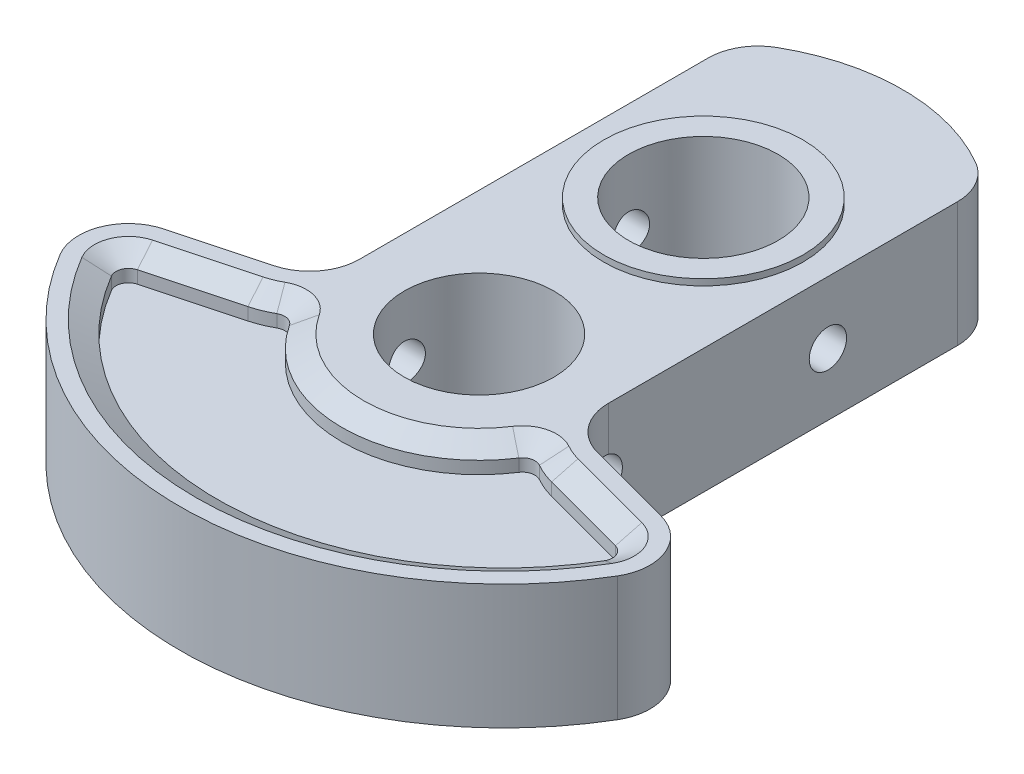
from build123d import *
from OCP.BRepFilletAPI import BRepFilletAPI_MakeChamfer

# Parameters (mm, degrees)
BOSS_EXTRUDE1_DEPTH     = 5
FILLET1_R               = 4
SKETCH3_R               = 8
BOSS_EXTRUDE2_DEPTH     = 0.5
SKETCH4_R               = 8
BOSS_EXTRUDE3_DEPTH     = 0.5
SKETCH5_R               = 6
CUT_EXTRUDE3_DEPTH      = 43.458169908
CUT_EXTRUDE4_DEPTH      = 2
CHAMFER1_SIZE           = 1
CHAMFER1_SIZE2          = 1.732050808
CHAMFER2_SIZE           = 1
CHAMFER2_SIZE2          = 1.732050808
CUT_EXTRUDE5_DEPTH      = 42.375671498
CUT_EXTRUDE5_DEPTH_BACK = 42.375671498
SKETCH7_R               = 1.5


with BuildPart() as part:
    # Sketch1 → Boss-Extrude1 (new, symmetric)
    with BuildSketch(Plane(origin=(0, 0, 0), x_dir=(1, 0, 0), z_dir=(0, 1, 0))):
        with BuildLine():
            Line((-10, 30.489995997), (-10, -2.679491924))
            Line((-10, -2.679491924), (-24.544650839, -6.576719371))
            ThreePointArc((-24.544650839, -6.576719371), (0, -24), (24.544650839, -6.576719371))
            Line((24.544650839, -6.576719371), (10, -2.679491924))
            Line((10, -2.679491924), (10, 30.489995997))
            ThreePointArc((10, 30.489995997), (0, 34), (-10, 30.489995997))
        make_face()
    extrude(amount=BOSS_EXTRUDE1_DEPTH, both=True)

    # Fillet1
    fillet1_edges = [part.edges().sort_by_distance(p)[0] for p in [
        (10, 0, -30.489995997),
        (10, 0, 2.679491924),
        (24.544650839, 0, 6.576719371),
        (-24.544650839, 0, 6.576719371),
        (-10, 0, 2.679491924),
        (-10, 0, -30.489995997),
    ]]
    fillet(fillet1_edges, radius=FILLET1_R)

    # Sketch3 → Boss-Extrude2 (add, symmetric)
    with BuildSketch(Plane.XZ.offset(5)):
        with Locations(Location((0, 0, 0), (0, 0, 90))):
            Circle(SKETCH3_R)
    extrude(amount=BOSS_EXTRUDE2_DEPTH, both=True)

    # Sketch4 → Boss-Extrude3 (add, symmetric)
    with BuildSketch(Plane(origin=(0, 5, 0), x_dir=(1, 0, 0), z_dir=(0, 1, 0))):
        with Locations(Location((0, 18, 0), (0, 0, 270))):
            Circle(SKETCH4_R)
    extrude(amount=BOSS_EXTRUDE3_DEPTH, both=True)

    # Sketch5 → Cut-Extrude3 (cut, through all)
    with BuildSketch(Plane.XZ.offset(5.5)):
        with Locations(Location((0, 0, 0), (0, 0, 270))):
            Circle(SKETCH5_R)
        with Locations(Location((0, -18, 0), (0, 0, 270))):
            Circle(SKETCH5_R)
    extrude(amount=-CUT_EXTRUDE3_DEPTH, mode=Mode.SUBTRACT)

    # Sketch6 → Cut-Extrude4 (cut)
    with BuildSketch(Plane(origin=(0, 5, 0), x_dir=(1, 0, 0), z_dir=(0, 1, 0))):
        with BuildLine():
            Line((12.188266684, -6.371664756), (19.186884641, -8.246938786))
            ThreePointArc((19.186884641, -8.246938786), (19.854075356, -8.835365045), (19.788432213, -9.722540276))
            ThreePointArc((19.788432213, -9.722540276), (0, -21), (-19.788432213, -9.722540276))
            ThreePointArc((-19.788432213, -9.722540276), (-19.854075356, -8.835365045), (-19.186884641, -8.246938786))
            Line((-19.186884641, -8.246938786), (-12.188266684, -6.371664756))
            ThreePointArc((-12.188266684, -6.371664756), (-11.342355786, -6.086056673), (-10.539679728, -5.695098402))
            ThreePointArc((-10.539679728, -5.695098402), (-9.810114884, -5.592432974), (-9.208235905, -6.017340901))
            ThreePointArc((-9.208235905, -6.017340901), (0, -11), (9.208235905, -6.017340901))
            ThreePointArc((9.208235905, -6.017340901), (9.810114884, -5.592432974), (10.539679728, -5.695098402))
            ThreePointArc((10.539679728, -5.695098402), (11.342355786, -6.086056673), (12.188266684, -6.371664756))
        make_face()
    cut_extrude4 = extrude(amount=-CUT_EXTRUDE4_DEPTH, mode=Mode.SUBTRACT)

    # Chamfer1: one chamfer whose edges measure the first distance from different faces: ONE call of the kernel's chamfer builder (chamfer() names one face for all edges)
    chamfer1_edges_1 = [part.edges().sort_by_distance(p)[0] for p in [
        (9.810114884, 5, 5.592432974),
    ]]
    chamfer1_side_1 = [part.faces().sort_by_distance(p)[0] for p in [
        (9.810114884, 4, 5.592432974),
    ]]
    chamfer1_edges_2 = [part.edges().sort_by_distance(p)[0] for p in [
        (0, 5, 11),
    ]]
    chamfer1_side_2 = [part.faces().sort_by_distance(p)[0] for p in [
        (0, 4, 11),
    ]]
    chamfer1_edges_3 = [part.edges().sort_by_distance(p)[0] for p in [
        (-9.810114884, 5, 5.592432974),
    ]]
    chamfer1_side_3 = [part.faces().sort_by_distance(p)[0] for p in [
        (-9.810114884, 4, 5.592432974),
    ]]
    chamfer1_edges_4 = [part.edges().sort_by_distance(p)[0] for p in [
        (-11.342355786, 5, 6.086056673),
    ]]
    chamfer1_side_4 = [part.faces().sort_by_distance(p)[0] for p in [
        (-11.342355786, 4, 6.086056673),
    ]]
    chamfer1_edges_5 = [part.edges().sort_by_distance(p)[0] for p in [
        (-15.687575662, 5, 7.309301771),
    ]]
    chamfer1_side_5 = [part.faces().sort_by_distance(p)[0] for p in [
        (-15.687575662, 4, 7.309301771),
    ]]
    chamfer1_edges_6 = [part.edges().sort_by_distance(p)[0] for p in [
        (-19.854075356, 5, 8.835365045),
    ]]
    chamfer1_side_6 = [part.faces().sort_by_distance(p)[0] for p in [
        (-19.854075356, 4, 8.835365045),
    ]]
    chamfer1_edges_7 = [part.edges().sort_by_distance(p)[0] for p in [
        (0, 5, 21),
    ]]
    chamfer1_side_7 = [part.faces().sort_by_distance(p)[0] for p in [
        (0, 4, 21),
    ]]
    chamfer1_edges_8 = [part.edges().sort_by_distance(p)[0] for p in [
        (19.854075356, 5, 8.835365045),
    ]]
    chamfer1_side_8 = [part.faces().sort_by_distance(p)[0] for p in [
        (19.854075356, 4, 8.835365045),
    ]]
    chamfer1_edges_9 = [part.edges().sort_by_distance(p)[0] for p in [
        (15.687575662, 5, 7.309301771),
    ]]
    chamfer1_side_9 = [part.faces().sort_by_distance(p)[0] for p in [
        (15.687575662, 4, 7.309301771),
    ]]
    chamfer1_edges_10 = [part.edges().sort_by_distance(p)[0] for p in [
        (11.342355786, 5, 6.086056673),
    ]]
    chamfer1_side_10 = [part.faces().sort_by_distance(p)[0] for p in [
        (11.342355786, 4, 6.086056673),
    ]]
    chamfer1 = BRepFilletAPI_MakeChamfer(part.part.solid().wrapped)
    for e in chamfer1_edges_1:
        chamfer1.Add(CHAMFER1_SIZE, CHAMFER1_SIZE2, e.wrapped, chamfer1_side_1[0].wrapped)  # the first distance lies on this face
    for e in chamfer1_edges_2:
        chamfer1.Add(CHAMFER1_SIZE, CHAMFER1_SIZE2, e.wrapped, chamfer1_side_2[0].wrapped)  # the first distance lies on this face
    for e in chamfer1_edges_3:
        chamfer1.Add(CHAMFER1_SIZE, CHAMFER1_SIZE2, e.wrapped, chamfer1_side_3[0].wrapped)  # the first distance lies on this face
    for e in chamfer1_edges_4:
        chamfer1.Add(CHAMFER1_SIZE, CHAMFER1_SIZE2, e.wrapped, chamfer1_side_4[0].wrapped)  # the first distance lies on this face
    for e in chamfer1_edges_5:
        chamfer1.Add(CHAMFER1_SIZE, CHAMFER1_SIZE2, e.wrapped, chamfer1_side_5[0].wrapped)  # the first distance lies on this face
    for e in chamfer1_edges_6:
        chamfer1.Add(CHAMFER1_SIZE, CHAMFER1_SIZE2, e.wrapped, chamfer1_side_6[0].wrapped)  # the first distance lies on this face
    for e in chamfer1_edges_7:
        chamfer1.Add(CHAMFER1_SIZE, CHAMFER1_SIZE2, e.wrapped, chamfer1_side_7[0].wrapped)  # the first distance lies on this face
    for e in chamfer1_edges_8:
        chamfer1.Add(CHAMFER1_SIZE, CHAMFER1_SIZE2, e.wrapped, chamfer1_side_8[0].wrapped)  # the first distance lies on this face
    for e in chamfer1_edges_9:
        chamfer1.Add(CHAMFER1_SIZE, CHAMFER1_SIZE2, e.wrapped, chamfer1_side_9[0].wrapped)  # the first distance lies on this face
    for e in chamfer1_edges_10:
        chamfer1.Add(CHAMFER1_SIZE, CHAMFER1_SIZE2, e.wrapped, chamfer1_side_10[0].wrapped)  # the first distance lies on this face
    add(Compound.cast(chamfer1.Shape()), mode=Mode.REPLACE)

    # Mirror5: Cut-Extrude4 across plane
    add(cut_extrude4.mirror(Plane.ZX), mode=Mode.SUBTRACT)

    # Chamfer2: one chamfer whose edges measure the first distance from different faces: ONE call of the kernel's chamfer builder (chamfer() names one face for all edges)
    chamfer2_edges_1 = [part.edges().sort_by_distance(p)[0] for p in [
        (9.810114884, -5, 5.592432974),
    ]]
    chamfer2_side_1 = [part.faces().sort_by_distance(p)[0] for p in [
        (9.810114884, -4, 5.592432974),
    ]]
    chamfer2_edges_2 = [part.edges().sort_by_distance(p)[0] for p in [
        (0, -5, 11),
    ]]
    chamfer2_side_2 = [part.faces().sort_by_distance(p)[0] for p in [
        (0, -4, 11),
    ]]
    chamfer2_edges_3 = [part.edges().sort_by_distance(p)[0] for p in [
        (-9.810114884, -5, 5.592432974),
    ]]
    chamfer2_side_3 = [part.faces().sort_by_distance(p)[0] for p in [
        (-9.810114884, -4, 5.592432974),
    ]]
    chamfer2_edges_4 = [part.edges().sort_by_distance(p)[0] for p in [
        (-11.342355786, -5, 6.086056673),
    ]]
    chamfer2_side_4 = [part.faces().sort_by_distance(p)[0] for p in [
        (-11.342355786, -4, 6.086056673),
    ]]
    chamfer2_edges_5 = [part.edges().sort_by_distance(p)[0] for p in [
        (-15.687575662, -5, 7.309301771),
    ]]
    chamfer2_side_5 = [part.faces().sort_by_distance(p)[0] for p in [
        (-15.687575662, -4, 7.309301771),
    ]]
    chamfer2_edges_6 = [part.edges().sort_by_distance(p)[0] for p in [
        (-19.854075356, -5, 8.835365045),
    ]]
    chamfer2_side_6 = [part.faces().sort_by_distance(p)[0] for p in [
        (-19.854075356, -4, 8.835365045),
    ]]
    chamfer2_edges_7 = [part.edges().sort_by_distance(p)[0] for p in [
        (0, -5, 21),
    ]]
    chamfer2_side_7 = [part.faces().sort_by_distance(p)[0] for p in [
        (0, -4, 21),
    ]]
    chamfer2_edges_8 = [part.edges().sort_by_distance(p)[0] for p in [
        (19.854075356, -5, 8.835365045),
    ]]
    chamfer2_side_8 = [part.faces().sort_by_distance(p)[0] for p in [
        (19.854075356, -4, 8.835365045),
    ]]
    chamfer2_edges_9 = [part.edges().sort_by_distance(p)[0] for p in [
        (15.687575662, -5, 7.309301771),
    ]]
    chamfer2_side_9 = [part.faces().sort_by_distance(p)[0] for p in [
        (15.687575662, -4, 7.309301771),
    ]]
    chamfer2_edges_10 = [part.edges().sort_by_distance(p)[0] for p in [
        (11.342355786, -5, 6.086056673),
    ]]
    chamfer2_side_10 = [part.faces().sort_by_distance(p)[0] for p in [
        (11.342355786, -4, 6.086056673),
    ]]
    chamfer2 = BRepFilletAPI_MakeChamfer(part.part.solid().wrapped)
    for e in chamfer2_edges_1:
        chamfer2.Add(CHAMFER2_SIZE, CHAMFER2_SIZE2, e.wrapped, chamfer2_side_1[0].wrapped)  # the first distance lies on this face
    for e in chamfer2_edges_2:
        chamfer2.Add(CHAMFER2_SIZE, CHAMFER2_SIZE2, e.wrapped, chamfer2_side_2[0].wrapped)  # the first distance lies on this face
    for e in chamfer2_edges_3:
        chamfer2.Add(CHAMFER2_SIZE, CHAMFER2_SIZE2, e.wrapped, chamfer2_side_3[0].wrapped)  # the first distance lies on this face
    for e in chamfer2_edges_4:
        chamfer2.Add(CHAMFER2_SIZE, CHAMFER2_SIZE2, e.wrapped, chamfer2_side_4[0].wrapped)  # the first distance lies on this face
    for e in chamfer2_edges_5:
        chamfer2.Add(CHAMFER2_SIZE, CHAMFER2_SIZE2, e.wrapped, chamfer2_side_5[0].wrapped)  # the first distance lies on this face
    for e in chamfer2_edges_6:
        chamfer2.Add(CHAMFER2_SIZE, CHAMFER2_SIZE2, e.wrapped, chamfer2_side_6[0].wrapped)  # the first distance lies on this face
    for e in chamfer2_edges_7:
        chamfer2.Add(CHAMFER2_SIZE, CHAMFER2_SIZE2, e.wrapped, chamfer2_side_7[0].wrapped)  # the first distance lies on this face
    for e in chamfer2_edges_8:
        chamfer2.Add(CHAMFER2_SIZE, CHAMFER2_SIZE2, e.wrapped, chamfer2_side_8[0].wrapped)  # the first distance lies on this face
    for e in chamfer2_edges_9:
        chamfer2.Add(CHAMFER2_SIZE, CHAMFER2_SIZE2, e.wrapped, chamfer2_side_9[0].wrapped)  # the first distance lies on this face
    for e in chamfer2_edges_10:
        chamfer2.Add(CHAMFER2_SIZE, CHAMFER2_SIZE2, e.wrapped, chamfer2_side_10[0].wrapped)  # the first distance lies on this face
    add(Compound.cast(chamfer2.Shape()), mode=Mode.REPLACE)

    # Sketch7 → Cut-Extrude5 (cut, two sides: drawn at the far end of the back side and taken through both)
    with BuildSketch(Plane(origin=(0, 0, 0), x_dir=(0, 0, -1), z_dir=(1, 0, 0)).offset(-CUT_EXTRUDE5_DEPTH_BACK)):
        Circle(SKETCH7_R)
        with Locations((18, 0)):
            Circle(SKETCH7_R)
    extrude(amount=CUT_EXTRUDE5_DEPTH + CUT_EXTRUDE5_DEPTH_BACK, mode=Mode.SUBTRACT)


solid = part.part
